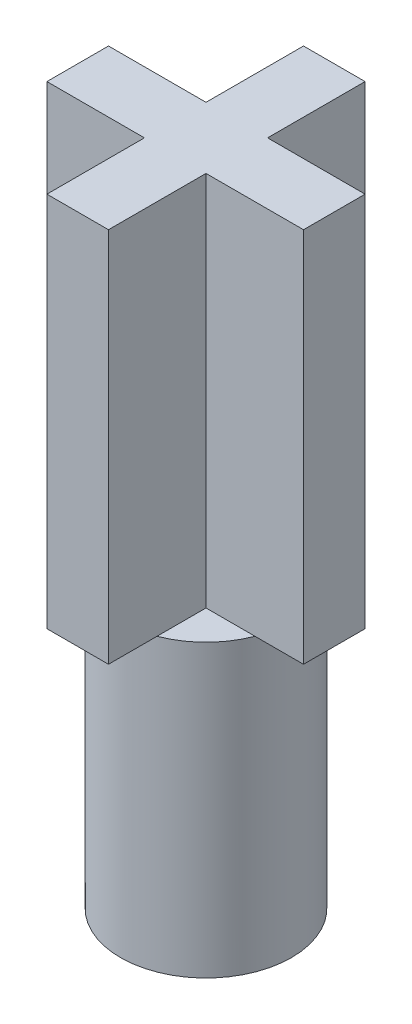
from build123d import *

# Parameters (mm, degrees)
EXTRUDE_2_DEPTH = 15
EXTRUDE_3_DEPTH = 2
EXTRUDE_4_DEPTH = 22


with BuildPart() as part:
    # 草图1 → 凸台-拉伸2 (new body)
    with BuildSketch(Plane(origin=(0, 0, 0), x_dir=(1, 0, 0), z_dir=(0, 1, 0))):
        with BuildLine():
            Line((-4.329004892, 2.501942574), (-4.329004892, -2.501942574))
            ThreePointArc((-4.329004892, -2.501942574), (5, 0), (-4.329004892, 2.501942574))
        make_face()
        with BuildLine():
            Line((-1.472222222, 2.203420461), (-1.472222222, -2.203420461))
            ThreePointArc((-1.472222222, -2.203420461), (2.65, 0), (-1.472222222, 2.203420461))
        make_face(mode=Mode.SUBTRACT)
    extrude(amount=EXTRUDE_2_DEPTH)

    # 草图2 → 凸台-拉伸3 (add)
    with BuildSketch(Plane(origin=(0, 15, 0), x_dir=(1, 0, 0), z_dir=(0, 1, 0))):
        with BuildLine():
            Line((-4.329004892, 2.501942574), (-4.329004892, -2.501942574))
            ThreePointArc((-4.329004892, -2.501942574), (5, 0), (-4.329004892, 2.501942574))
        make_face()
    extrude(amount=EXTRUDE_3_DEPTH)

    # 草图3 → 凸台-拉伸4 (add)
    with BuildSketch(Plane(origin=(0, 17, 0), x_dir=(1, 0, 0), z_dir=(0, 1, 0))):
        Polygon((-7.5, 0), (-7.5, 1.8), (-1.8, 1.8), (-1.8, 7.5), (0, 7.5), (1.8, 7.5), (1.8, 1.8), (7.5, 1.8), (7.5, -1.8), (1.8, -1.8), (1.8, -7.5), (-1.8, -7.5), (-1.8, -1.8), (-7.5, -1.8), align=None)
    extrude(amount=EXTRUDE_4_DEPTH)


solid = part.part
